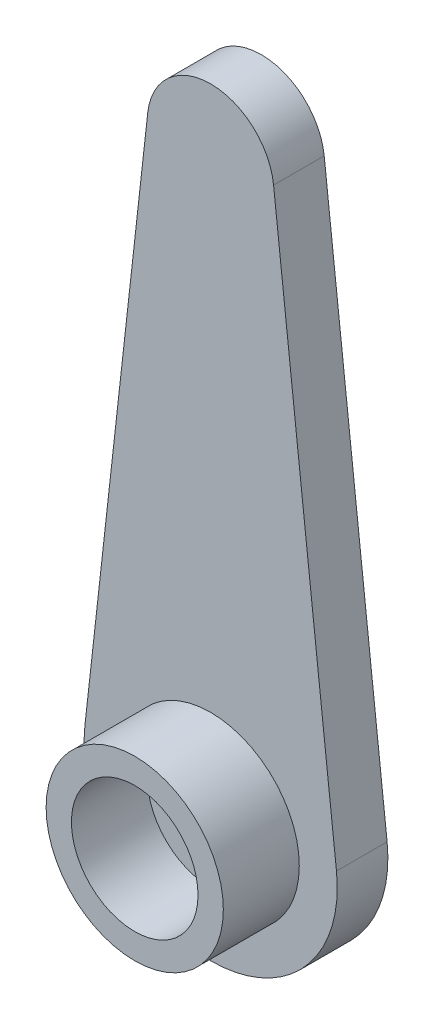
from build123d import *

# Parameters (mm, degrees)
EXTRUDE_1_DEPTH = 2
SKETCH_2_R      = 3.5
SKETCH_2_R_2    = 2.5
EXTRUDE_2_DEPTH = 3


with BuildPart() as part:
    # 草图1 → 凸台-拉伸1 (new body)
    with BuildSketch(Plane.XY):
        with BuildLine():
            Line((-4.96903995, 0.555555556), (-2.484519975, 22.777777778))
            ThreePointArc((-2.484519975, 22.777777778), (0, 25), (2.484519975, 22.777777778))
            Line((2.484519975, 22.777777778), (4.96903995, 0.555555556))
            ThreePointArc((4.96903995, 0.555555556), (0, -5), (-4.96903995, 0.555555556))
        make_face()
    extrude(amount=EXTRUDE_1_DEPTH)

    # 草图2 → 凸台-拉伸2 (add)
    with BuildSketch(Plane.XY.offset(2)):
        Circle(SKETCH_2_R)
        Circle(SKETCH_2_R_2, mode=Mode.SUBTRACT)
    extrude(amount=EXTRUDE_2_DEPTH)


solid = part.part
